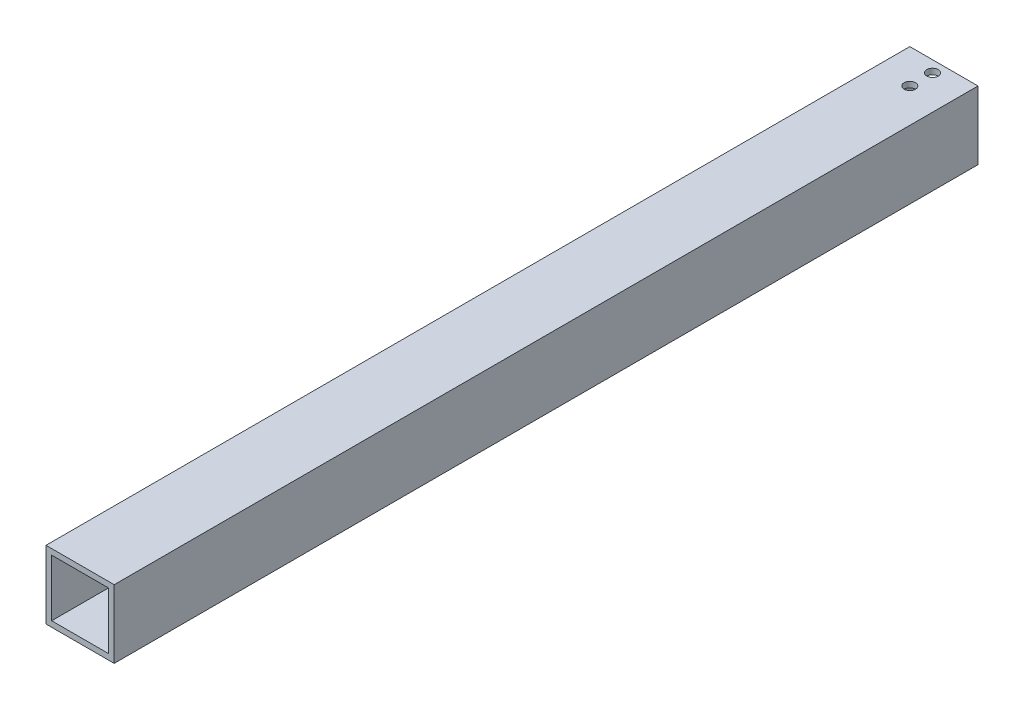
from build123d import *

# Parameters (mm, degrees)
SKETCH1_W           = 38.1
SKETCH1_H           = 38.1
SKETCH1_W_2         = 31.75
SKETCH1_H_2         = 31.75
BOSS_EXTRUDE1_DEPTH = 482.6
SKETCH2_R           = 3.175
CUT_EXTRUDE1_DEPTH  = 485.476286829


with BuildPart() as part:
    # Sketch1 → Boss-Extrude1 (new body)
    with BuildSketch(Plane.XY):
        Rectangle(SKETCH1_W, SKETCH1_H)
        Rectangle(SKETCH1_W_2, SKETCH1_H_2, mode=Mode.SUBTRACT)
    extrude(amount=BOSS_EXTRUDE1_DEPTH)

    # Sketch2 → Cut-Extrude1 (cut, through all)
    with BuildSketch(Plane(origin=(0, 19.05, 0), x_dir=(1, 0, 0), z_dir=(0, 1, 0))):
        with Locations(Location((0, -19.05, 0), (0, 0, 270))):
            Circle(SKETCH2_R)
        with Locations(Location((0, -6.35, 0), (0, 0, 270))):
            Circle(SKETCH2_R)
    extrude(amount=-CUT_EXTRUDE1_DEPTH, mode=Mode.SUBTRACT)


solid = part.part
